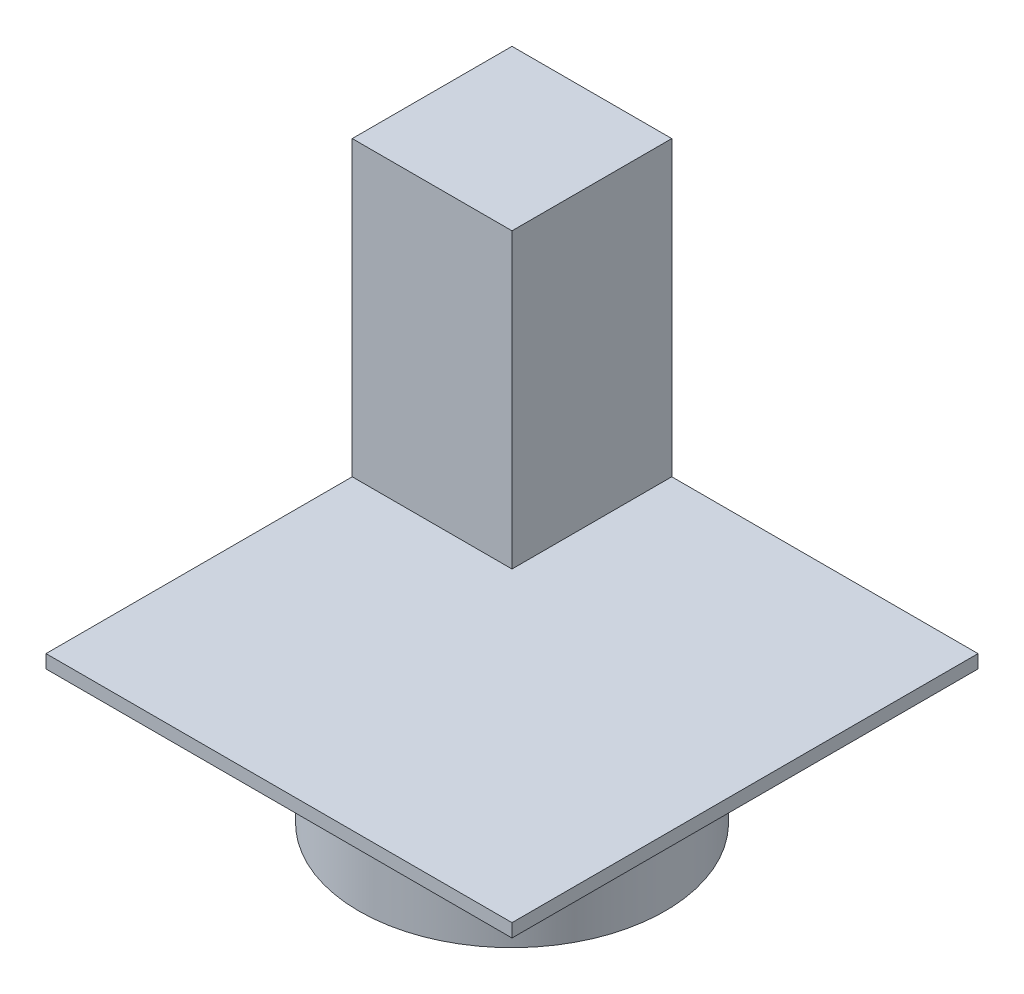
from build123d import *

# Parameters (mm, degrees)
SKETCH1_W           = 35
SKETCH1_H           = 35
BOSS_EXTRUDE1_DEPTH = 1
SKETCH2_W           = 12
SKETCH2_H           = 12
BOSS_EXTRUDE2_DEPTH = 22
SKETCH3_R           = 11.5
SKETCH3_R_2         = 10.25
BOSS_EXTRUDE3_DEPTH = 10


with BuildPart() as part:
    # Sketch1 → Boss-Extrude1 (new body)
    with BuildSketch(Plane(origin=(0, 0, 0), x_dir=(1, 0, 0), z_dir=(0, 1, 0))):
        with Locations((17.5, 17.5)):
            Rectangle(SKETCH1_W, SKETCH1_H)
    extrude(amount=BOSS_EXTRUDE1_DEPTH)

    # Sketch2 → Boss-Extrude2 (add)
    with BuildSketch(Plane(origin=(0, 1, 0), x_dir=(1, 0, 0), z_dir=(0, 1, 0))):
        with Locations((6, 29)):
            Rectangle(SKETCH2_W, SKETCH2_H)
    extrude(amount=BOSS_EXTRUDE2_DEPTH)

    # Sketch3 → Boss-Extrude3 (add)
    with BuildSketch(Plane.XZ):
        with Locations(Location((17.5, -17.5, 0), (0, 0, 270))):
            Circle(SKETCH3_R)
        with Locations(Location((17.5, -17.5, 0), (0, 0, 270))):
            Circle(SKETCH3_R_2, mode=Mode.SUBTRACT)
    extrude(amount=BOSS_EXTRUDE3_DEPTH)


solid = part.part
